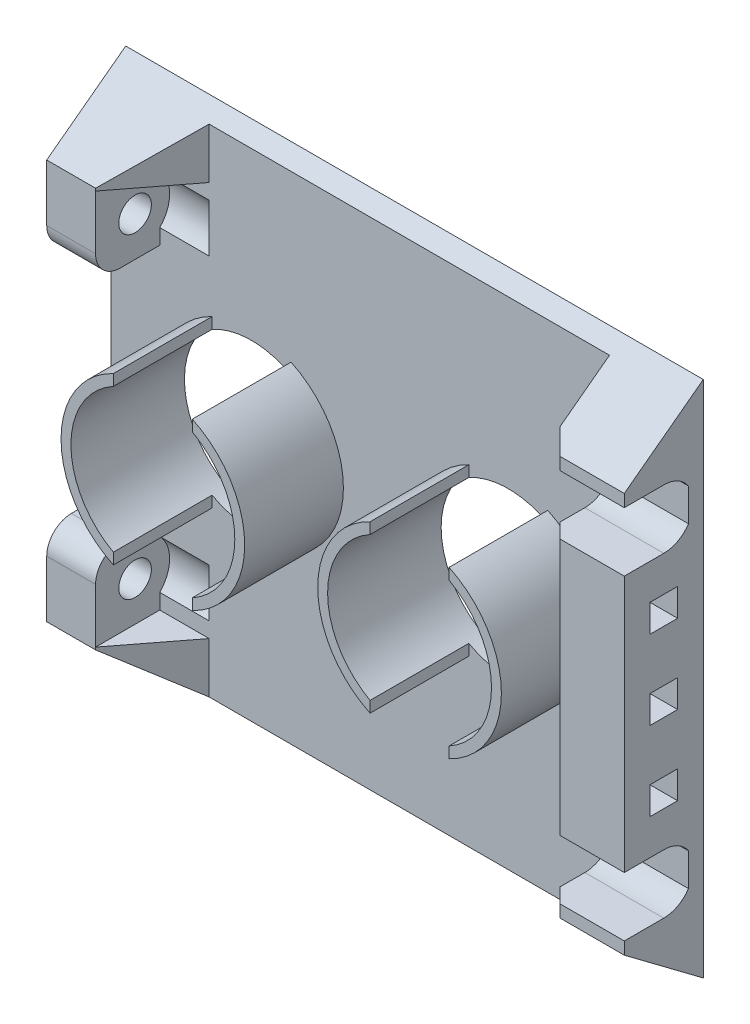
from build123d import *
from build123d.topology import SkipClean

# Parameters (mm, degrees)
ESBO_O1_R                 = 8.3
RESSALTO_EXTRUS_O1_DEPTH  = 1.5
RESSALTO_EXTRUS_O2_DEPTH  = 6
ESBO_O3_W                 = 2.8
ESBO_O3_H                 = 2.8
CORTE_EXTRUS_O1_DEPTH     = 37.142080737
ESBO_O4_W                 = 2.8
ESBO_O4_H                 = 2.8
CORTE_EXTRUS_O2_DEPTH     = 53.08166664
ESBO_O6_W                 = 5
ESBO_O6_H                 = 25
RESSALTO_EXTRUS_O5_DEPTH  = 7.5
ESBO_O7_W                 = 2.8
ESBO_O7_H                 = 2.8
CORTE_EXTRUS_O3_DEPTH     = 60
RESSALTO_EXTRUS_O3_DEPTH  = 10
ESBO_O8_W                 = 60
ESBO_O8_H                 = 52.5
ESBO_O8_R                 = 8.3
RESSALTO_EXTRUS_O6_DEPTH  = 1.5
CORTE_EXTRUS_O4_DEPTH     = 42.098205557
RESSALTO_EXTRUS_O7_DEPTH  = 6.5
ESBO_O14_W                = 5.7
ESBO_O14_H                = 52.5
CORTE_EXTRUS_O8_DEPTH     = 4.5
CORTE_EXTRUS_O9_DEPTH     = 41.657871317
CORTE_EXTRUS_O13_DEPTH    = 6.25
CORTE_EXTRUS_O14_DEPTH    = 6.25
ESBO_O12_R                = 1.65
CORTE_EXTRUS_O15_DEPTH    = 4.5
CORTE_EXTRUS_O17_DEPTH    = 62.398717413
ESBO_O20_R                = 3.5
CORTE_EXTRUS_O18_DEPTH    = 5
RESSALTO_EXTRUS_O8_START  = 2.95
ESBO_O21_R                = 1.65
RESSALTO_EXTRUS_O8_DEPTH  = 2.95
ESBO_O22_W                = 2.8
ESBO_O22_H                = 2.8
RESSALTO_EXTRUS_O9_DEPTH  = 1.25
CORTE_EXTRUS_O19_DEPTH    = 6
ESBO_O24_W                = 8
ESBO_O24_H                = 50.25
RESSALTO_EXTRUS_O10_DEPTH = 6.5
CORTE_EXTRUS_O20_DEPTH    = 62.222570389
CORTE_EXTRUS_O21_REACH    = 67.143
ESBO_O26_W                = 2.8
ESBO_O26_H                = 2.8
CORTE_EXTRUS_O22_REACH    = 67.143
CORTE_EXTRUS_O23_DEPTH    = 6.5
CORTE_EXTRUS_O24_DEPTH    = 6.5
CORTE_EXTRUS_O25_START    = -6.5
CORTE_EXTRUS_O25_DEPTH    = 6.5
CORTE_EXTRUS_O26_DEPTH    = 4.95


with BuildPart() as part:
    # Esboço1 → Ressalto-extrusão1 (new body)
    with BuildSketch(Plane.XY):
        Polygon((-25, -12.5), (-25, 12.5), (25, 12.5), (25, -12.5), (15, -12.5), (-15, -12.5), align=None)
        with Locations((-13, 0)):
            Circle(ESBO_O1_R, mode=Mode.SUBTRACT)
        with Locations(Location((13, 0, 0), (0, 0, 180))):
            Circle(ESBO_O1_R, mode=Mode.SUBTRACT)
    extrude(amount=RESSALTO_EXTRUS_O1_DEPTH)

    # Esboço2 → Ressalto-extrusão2 (add)
    with BuildSketch(Plane.XY.offset(1.5)):
        Polygon((-20, -12.5), (-25, -12.5), (-25, -2.5), (-22, -2.5), (-22, -9.5), (-15, -9.5), (-15, -12.5), align=None)
        Polygon((22, -2.5), (22, -9.5), (15, -9.5), (15, -12.5), (20, -12.5), (25, -12.5), (25, -2.5), align=None)
        Polygon((20, 12.5), (25, 12.5), (25, 2.5), (22, 2.5), (22, 9.5), (15, 9.5), (15, 12.5), align=None)
        Polygon((-22, 2.5), (-22, 9.5), (-15, 9.5), (-15, 12.5), (-20, 12.5), (-25, 12.5), (-25, 2.5), align=None)
    extrude(amount=RESSALTO_EXTRUS_O2_DEPTH)

    # Esboço3 → Corte-extrusão1 (cut, through all)
    with BuildSketch(Plane.XZ.offset(12.5)):
        with Locations((-20, 3.75)):
            Rectangle(ESBO_O3_W, ESBO_O3_H)
        with Locations((20, 3.75)):
            Rectangle(ESBO_O3_W, ESBO_O3_H)
    extrude(amount=-CORTE_EXTRUS_O1_DEPTH, mode=Mode.SUBTRACT)

    # Esboço4 → Corte-extrusão2 (cut, through all)
    with BuildSketch(Plane.ZY.offset(25)):
        with Locations((3.75, 7.5)):
            Rectangle(ESBO_O4_W, ESBO_O4_H)
        with Locations((3.75, -7.5)):
            Rectangle(ESBO_O4_W, ESBO_O4_H)
    extrude(amount=-CORTE_EXTRUS_O2_DEPTH, mode=Mode.SUBTRACT)

    # Esboço6 → Ressalto-extrusão5 (add)
    with BuildSketch(Plane(origin=(0, 0, 0), x_dir=(-1, 0, 0), z_dir=(0, 0, -1))):
        with Locations((-27.5, 0)):
            Rectangle(ESBO_O6_W, ESBO_O6_H)
        with Locations((27.5, 0)):
            Rectangle(ESBO_O6_W, ESBO_O6_H)
    extrude(amount=-RESSALTO_EXTRUS_O5_DEPTH)

    # Esboço7 → Corte-extrusão3 (cut)
    with BuildSketch(Plane(origin=(30, 0, 0), x_dir=(0, 0, -1), z_dir=(1, 0, 0))):
        with Locations((-3.75, -7.5)):
            Rectangle(ESBO_O7_W, ESBO_O7_H)
        with Locations((-3.75, 7.5)):
            Rectangle(ESBO_O7_W, ESBO_O7_H)
    extrude(amount=-CORTE_EXTRUS_O3_DEPTH, mode=Mode.SUBTRACT)

    # Esboço5 → Ressalto-extrusão3 (add)
    with SkipClean():  # the faces are left unmerged after this step: merging them gives an invalid solid
        with BuildSketch(Plane.XY.offset(1.5)):
            with BuildLine():
                Line((-9, -7.272551134), (-9, -8.395832299))
                ThreePointArc((-9, -8.395832299), (-3.7, 0), (-9, 8.395832299))
                Line((-9, 8.395832299), (-9, 7.272551134))
                ThreePointArc((-9, 7.272551134), (-4.7, 0), (-9, -7.272551134))
            make_face()
            with BuildLine():
                Line((-17, -7.272551134), (-17, -8.395832299))
                ThreePointArc((-17, -8.395832299), (-22.3, 0), (-17, 8.395832299))
                Line((-17, 8.395832299), (-17, 7.272551134))
                ThreePointArc((-17, 7.272551134), (-21.3, 0), (-17, -7.272551134))
            make_face()
            with BuildLine():
                Line((9, -7.272551134), (9, -8.395832299))
                ThreePointArc((9, -8.395832299), (3.7, 0), (9, 8.395832299))
                Line((9, 8.395832299), (9, 7.272551134))
                ThreePointArc((9, 7.272551134), (4.7, 0), (9, -7.272551134))
            make_face()
            with BuildLine():
                Line((17, 8.395832299), (17, 7.272551134))
                ThreePointArc((17, 7.272551134), (21.3, 0), (17, -7.272551134))
                Line((17, -7.272551134), (17, -8.395832299))
                ThreePointArc((17, -8.395832299), (22.3, 0), (17, 8.395832299))
            make_face()
        extrude(amount=RESSALTO_EXTRUS_O3_DEPTH)

    # Esboço8 → Ressalto-extrusão6 (add)
    with SkipClean():  # the faces are left unmerged after this step: merging them gives an invalid solid
        with BuildSketch(Plane(origin=(0, 0, 0), x_dir=(-1, 0, 0), z_dir=(0, 0, -1))):
            Rectangle(ESBO_O8_W, ESBO_O8_H)
            with Locations(Location((13, 0, 0), (0, 0, 298.811379709))):
                Circle(ESBO_O8_R, mode=Mode.SUBTRACT)
            with Locations((-13, 0)):
                Circle(ESBO_O8_R, mode=Mode.SUBTRACT)
        extrude(amount=-RESSALTO_EXTRUS_O6_DEPTH)

    # Esboço9 → Corte-extrusão4 (cut, through all)
    with SkipClean():  # the faces are left unmerged after this step: merging them gives an invalid solid
        with BuildSketch(Plane.XY.offset(1.5)):
            Polygon((-15, -12.5), (-15, -9.5), (-22, -9.5), (-22, -2.5), (-25, -2.5), (-25, 2.5), (-22, 2.5), (-22, 9.5), (-15, 9.5), (-15, 12.5), (-30, 12.5), (-30, -12.5), align=None)
        extrude(amount=CORTE_EXTRUS_O4_DEPTH, mode=Mode.SUBTRACT)

    # Esboço10 → Ressalto-extrusão7 (add)
    with SkipClean():  # the faces are left unmerged after this step: merging them gives an invalid solid
        with BuildSketch(Plane.XY.offset(1.5)):
            Polygon((-24.3, -26.25), (-24.3, 26.25), (-22.3, 26.25), (-17.3, 26.25), (-17.3, 20), (-22.3, 20), (-22.3, 12), (-17.3, 12), (-17.3, -12), (-22.3, -12), (-22.3, -20), (-17.3, -20), (-17.3, -26.25), (-22.3, -26.25), align=None)
        extrude(amount=RESSALTO_EXTRUS_O7_DEPTH)

    # Esboço14 → Corte-extrusão8 (cut)
    with SkipClean():  # the faces are left unmerged after this step: merging them gives an invalid solid
        with BuildSketch(Plane.XY.offset(1.5)):
            with Locations((-27.15, 0)):
                Rectangle(ESBO_O14_W, ESBO_O14_H)
        extrude(amount=-CORTE_EXTRUS_O8_DEPTH, mode=Mode.SUBTRACT)

    # Esboço15 → Corte-extrusão9 (cut, through all)
    with SkipClean():  # the faces are left unmerged after this step: merging them gives an invalid solid
        with BuildSketch(Plane.XY.offset(8)):
            with BuildLine():
                Line((-17.3, -7.09929574), (-17.3, 7.09929574))
                ThreePointArc((-17.3, 7.09929574), (-21.3, 0), (-17.3, -7.09929574))
            make_face()
        extrude(amount=-CORTE_EXTRUS_O9_DEPTH, mode=Mode.SUBTRACT)

    # Esboço11 → Corte-extrusão13 (cut)
    with SkipClean():  # the faces are left unmerged after this step: merging them gives an invalid solid
        with BuildSketch(Plane.XZ.offset(26.25)):
            Polygon((-22.3, 8), (-17.3, 8), (-17.3, 1.5), align=None)
        extrude(amount=-CORTE_EXTRUS_O13_DEPTH, mode=Mode.SUBTRACT)

    # Esboço17 → Corte-extrusão14 (cut)
    with SkipClean():  # the faces are left unmerged after this step: merging them gives an invalid solid
        with BuildSketch(Plane(origin=(0, 26.25, 0), x_dir=(1, 0, 0), z_dir=(0, 1, 0))):
            Polygon((-17.3, -1.5), (-17.3, -8), (-22.3, -8), align=None)
        extrude(amount=-CORTE_EXTRUS_O14_DEPTH, mode=Mode.SUBTRACT)

    # Esboço12 → Corte-extrusão15 (cut)
    with SkipClean():  # the faces are left unmerged after this step: merging them gives an invalid solid
        with BuildSketch(Plane.ZY.offset(24.3)):
            with Locations(Location((4, 16, 0), (0, 0, 270))):
                Circle(ESBO_O12_R)
            with Locations((4, -16)):
                Circle(ESBO_O12_R)
        extrude(amount=-CORTE_EXTRUS_O15_DEPTH, mode=Mode.SUBTRACT)

    # Esboço19 → Corte-extrusão17 (cut, through all)
    with SkipClean():  # the faces are left unmerged after this step: merging them gives an invalid solid
        with BuildSketch(Plane.ZY.offset(24.3)):
            Polygon((0, 26.25), (8, 26.25), (8, 20.25), align=None)
            Polygon((8, -20.25), (0, -26.25), (8, -26.25), align=None)
        extrude(amount=-CORTE_EXTRUS_O17_DEPTH, mode=Mode.SUBTRACT)

    # Esboço20 → Corte-extrusão18 (cut)
    with SkipClean():  # the faces are left unmerged after this step: merging them gives an invalid solid
        with BuildSketch(Plane(origin=(-22.3, 0, 0), x_dir=(0, 0, -1), z_dir=(1, 0, 0))):
            with Locations((-4, -16)):
                Circle(ESBO_O20_R)
            with Locations((-4, 16)):
                Circle(ESBO_O20_R)
        extrude(amount=CORTE_EXTRUS_O18_DEPTH, mode=Mode.SUBTRACT)

    # Esboço21 → Ressalto-extrusão8 (add)
    with SkipClean():  # the faces are left unmerged after this step: merging them gives an invalid solid
        with BuildSketch(Plane.ZY.offset(24.3).offset(RESSALTO_EXTRUS_O8_START)):
            Polygon((0, 26.25), (0, -26.25), (8, -20.25), (8, 20.25), align=None)
            with Locations(Location((4, -16, 0), (0, 0, 270))):
                Circle(ESBO_O21_R, mode=Mode.SUBTRACT)
            with Locations(Location((4, 16, 0), (0, 0, 270))):
                Circle(ESBO_O21_R, mode=Mode.SUBTRACT)
        extrude(amount=-RESSALTO_EXTRUS_O8_DEPTH)

    # Esboço22 → Ressalto-extrusão9 (add)
    with SkipClean():  # the faces are left unmerged after this step: merging them gives an invalid solid
        with BuildSketch(Plane(origin=(30, 0, 0), x_dir=(0, 0, -1), z_dir=(1, 0, 0))):
            Polygon((-1.5, -25.125), (0, -26.25), (0, 26.25), (-1.5, 25.125), (-1.5, 12.5), (-7.5, 12.5), (-7.5, -12.5), (-1.5, -12.5), align=None)
            with Locations((-3.75, -7.5)):
                Rectangle(ESBO_O22_W, ESBO_O22_H, mode=Mode.SUBTRACT)
            with Locations((-3.75, 7.5)):
                Rectangle(ESBO_O22_W, ESBO_O22_H, mode=Mode.SUBTRACT)
        extrude(amount=RESSALTO_EXTRUS_O9_DEPTH)

    # Esboço23 → Corte-extrusão19 (cut)
    with SkipClean():  # the faces are left unmerged after this step: merging them gives an invalid solid
        with BuildSketch(Plane.XY.offset(7.5)):
            Polygon((25, -2.5), (22, -2.5), (22, -9.5), (15, -9.5), (15, -12.5), (31.25, -12.5), (31.25, 12.5), (15, 12.5), (15, 9.5), (22, 9.5), (22, 2.5), (25, 2.5), align=None)
        extrude(amount=-CORTE_EXTRUS_O19_DEPTH, mode=Mode.SUBTRACT)

    # Esboço24 → Ressalto-extrusão10 (add)
    with SkipClean():  # the faces are left unmerged after this step: merging them gives an invalid solid
        with BuildSketch(Plane.XY.offset(1.5)):
            with Locations((27.25, 0)):
                Rectangle(ESBO_O24_W, ESBO_O24_H)
        extrude(amount=RESSALTO_EXTRUS_O10_DEPTH)

    # Esboço25 → Corte-extrusão20 (cut, through all)
    with SkipClean():  # the faces are left unmerged after this step: merging them gives an invalid solid
        with BuildSketch(Plane(origin=(0, 25.125, 0), x_dir=(1, 0, 0), z_dir=(0, 1, 0))):
            Polygon((23.25, -6.5), (23.25, -8), (24.75, -8), align=None)
        extrude(amount=-CORTE_EXTRUS_O20_DEPTH, mode=Mode.SUBTRACT)

    # Esboço26 → Corte-extrusão21 (cut, up to next)
    with BuildSketch(Plane(origin=(31.25, 0, 0), x_dir=(0, 0, -1), z_dir=(1, 0, 0)), mode=Mode.PRIVATE) as corte_extrus_o21_sk1:
        with Locations((-4, 0)):
            Rectangle(ESBO_O26_W, ESBO_O26_H)
    corte_extrus_o21_tool1 = extrude(corte_extrus_o21_sk1.sketch, amount=-CORTE_EXTRUS_O21_REACH, mode=Mode.PRIVATE) & part.part
    # Esboço26 → Corte-extrusão21 (cut, up to next)
    with BuildSketch(Plane(origin=(31.25, 0, 0), x_dir=(0, 0, -1), z_dir=(1, 0, 0)), mode=Mode.PRIVATE) as corte_extrus_o21_sk2:
        with Locations((-4, -8)):
            Rectangle(ESBO_O26_W, ESBO_O26_H)
    corte_extrus_o21_tool2 = extrude(corte_extrus_o21_sk2.sketch, amount=-CORTE_EXTRUS_O21_REACH, mode=Mode.PRIVATE) & part.part
    # Esboço26 → Corte-extrusão21 (cut, up to next)
    with BuildSketch(Plane(origin=(31.25, 0, 0), x_dir=(0, 0, -1), z_dir=(1, 0, 0)), mode=Mode.PRIVATE) as corte_extrus_o21_sk3:
        with Locations((-4, 8)):
            Rectangle(ESBO_O26_W, ESBO_O26_H)
    corte_extrus_o21_tool3 = extrude(corte_extrus_o21_sk3.sketch, amount=-CORTE_EXTRUS_O21_REACH, mode=Mode.PRIVATE) & part.part
    add(corte_extrus_o21_tool1.solids().sort_by_distance((31.25, 0, 4))[0], mode=Mode.SUBTRACT)
    add(corte_extrus_o21_tool2.solids().sort_by_distance((31.25, -8, 4))[0], mode=Mode.SUBTRACT)
    add(corte_extrus_o21_tool3.solids().sort_by_distance((31.25, 8, 4))[0], mode=Mode.SUBTRACT)

    # Esboço27 → Corte-extrusão22 (cut, up to next)
    with BuildSketch(Plane(origin=(31.25, 0, 0), x_dir=(0, 0, -1), z_dir=(1, 0, 0)), mode=Mode.PRIVATE) as corte_extrus_o22_sk1:
        with BuildLine():
            Line((-4, 19), (-8, 19))
            Line((-8, 19), (-8, 13))
            Line((-8, 13), (-4, 13))
            ThreePointArc((-4, 13), (-2.581362835, 13.356617963), (-1.5, 14.341687605))
            Line((-1.5, 14.341687605), (-1.5, 17.658312395))
            ThreePointArc((-1.5, 17.658312395), (-2.581362835, 18.643382037), (-4, 19))
        make_face()
    corte_extrus_o22_tool1 = extrude(corte_extrus_o22_sk1.sketch, amount=-CORTE_EXTRUS_O22_REACH, mode=Mode.PRIVATE) & part.part
    # Esboço27 → Corte-extrusão22 (cut, up to next)
    with BuildSketch(Plane(origin=(31.25, 0, 0), x_dir=(0, 0, -1), z_dir=(1, 0, 0)), mode=Mode.PRIVATE) as corte_extrus_o22_sk2:
        Polygon((-8, -20.25), (-8, -25.125), (-1.5, -25.125), align=None)
    corte_extrus_o22_tool2 = extrude(corte_extrus_o22_sk2.sketch, amount=-CORTE_EXTRUS_O22_REACH, mode=Mode.PRIVATE) & part.part
    # Esboço27 → Corte-extrusão22 (cut, up to next)
    with BuildSketch(Plane(origin=(31.25, 0, 0), x_dir=(0, 0, -1), z_dir=(1, 0, 0)), mode=Mode.PRIVATE) as corte_extrus_o22_sk3:
        Polygon((-8, 25.125), (-8, 20.25), (-1.5, 25.125), align=None)
    corte_extrus_o22_tool3 = extrude(corte_extrus_o22_sk3.sketch, amount=-CORTE_EXTRUS_O22_REACH, mode=Mode.PRIVATE) & part.part
    # Esboço27 → Corte-extrusão22 (cut, up to next)
    with BuildSketch(Plane(origin=(31.25, 0, 0), x_dir=(0, 0, -1), z_dir=(1, 0, 0)), mode=Mode.PRIVATE) as corte_extrus_o22_sk4:
        with BuildLine():
            Line((-4, -13), (-8, -13))
            Line((-8, -13), (-8, -19))
            Line((-8, -19), (-4, -19))
            ThreePointArc((-4, -19), (-2.581362835, -18.643382037), (-1.5, -17.658312395))
            Line((-1.5, -17.658312395), (-1.5, -14.341687605))
            ThreePointArc((-1.5, -14.341687605), (-2.581362835, -13.356617963), (-4, -13))
        make_face()
    corte_extrus_o22_tool4 = extrude(corte_extrus_o22_sk4.sketch, amount=-CORTE_EXTRUS_O22_REACH, mode=Mode.PRIVATE) & part.part
    add(corte_extrus_o22_tool1.solids().sort_by_distance((31.25, 16, 4.892695))[0], mode=Mode.SUBTRACT)
    add(corte_extrus_o22_tool2.solids().sort_by_distance((31.25, -23.5, 5.833333))[0], mode=Mode.SUBTRACT)
    add(corte_extrus_o22_tool3.solids().sort_by_distance((31.25, 23.5, 5.833333))[0], mode=Mode.SUBTRACT)
    add(corte_extrus_o22_tool4.solids().sort_by_distance((31.25, -16, 4.892695))[0], mode=Mode.SUBTRACT)

    # Esboço28 → Corte-extrusão23 (cut)
    with SkipClean():  # the faces are left unmerged after this step: merging them gives an invalid solid
        with BuildSketch(Plane.XY.offset(8)):
            with BuildLine():
                Line((-27.25, 12), (-27.25, -12))
                Line((-27.25, -12), (-24.8, -12))
                ThreePointArc((-24.8, -12), (-23.032233047, -11.267766953), (-22.3, -9.5))
                Line((-22.3, -9.5), (-22.3, 9.5))
                ThreePointArc((-22.3, 9.5), (-23.032233047, 11.267766953), (-24.8, 12))
                Line((-24.8, 12), (-27.25, 12))
            make_face()
        extrude(amount=-CORTE_EXTRUS_O23_DEPTH, mode=Mode.SUBTRACT)

    # Esboço29 → Corte-extrusão24 (cut)
    with SkipClean():  # the faces are left unmerged after this step: merging them gives an invalid solid
        with BuildSketch(Plane.XY.offset(8)):
            with BuildLine():
                Line((-19.8, -12), (-19.8, -12.44923286))
                Line((-19.8, -12.44923286), (-19.8, -14.139655276))
                Line((-19.8, -14.139655276), (-15.225886581, -14.139655276))
                Line((-15.225886581, -14.139655276), (-15.225886581, -9.5))
                Line((-15.225886581, -9.5), (-17.3, -9.5))
                ThreePointArc((-17.3, -9.5), (-18.032233047, -11.267766953), (-19.8, -12))
            make_face()
            with BuildLine():
                Line((-19.8, 12), (-19.8, 12.907103379))
                Line((-19.8, 12.907103379), (-15.750500434, 12.907103379))
                Line((-15.750500434, 12.907103379), (-15.750500434, 9.5))
                Line((-15.750500434, 9.5), (-17.3, 9.5))
                ThreePointArc((-17.3, 9.5), (-18.032233047, 11.267766953), (-19.8, 12))
            make_face()
        extrude(amount=-CORTE_EXTRUS_O24_DEPTH, mode=Mode.SUBTRACT)

    # Esboço30 → Corte-extrusão25 (cut)
    with SkipClean():  # the faces are left unmerged after this step: merging them gives an invalid solid
        with BuildSketch(Plane.XY.offset(8).offset(CORTE_EXTRUS_O25_START)):
            with BuildLine():
                Line((-27.25, 12), (-17, 12))
                Line((-17, 12), (-17, 8.395832299))
                ThreePointArc((-17, 8.395832299), (-22.3, 0), (-17, -8.395832299))
                Line((-17, -8.395832299), (-17, -12))
                Line((-17, -12), (-27.25, -12))
                Line((-27.25, -12), (-27.25, 12))
            make_face()
        extrude(amount=CORTE_EXTRUS_O25_DEPTH, mode=Mode.SUBTRACT)

    # Esboço31 → Corte-extrusão26 (cut)
    with SkipClean():  # the faces are left unmerged after this step: merging them gives an invalid solid
        with BuildSketch(Plane.ZY.offset(27.25)):
            with BuildLine():
                Line((5.5, -12), (8, -12))
                Line((8, -12), (8, -14.5))
                ThreePointArc((8, -14.5), (7.267766953, -12.732233047), (5.5, -12))
            make_face()
            with BuildLine():
                Line((5.5, 12), (8, 12))
                Line((8, 12), (8, 14.5))
                ThreePointArc((8, 14.5), (7.267766953, 12.732233047), (5.5, 12))
            make_face()
        extrude(amount=-CORTE_EXTRUS_O26_DEPTH, mode=Mode.SUBTRACT)


solid = part.part
